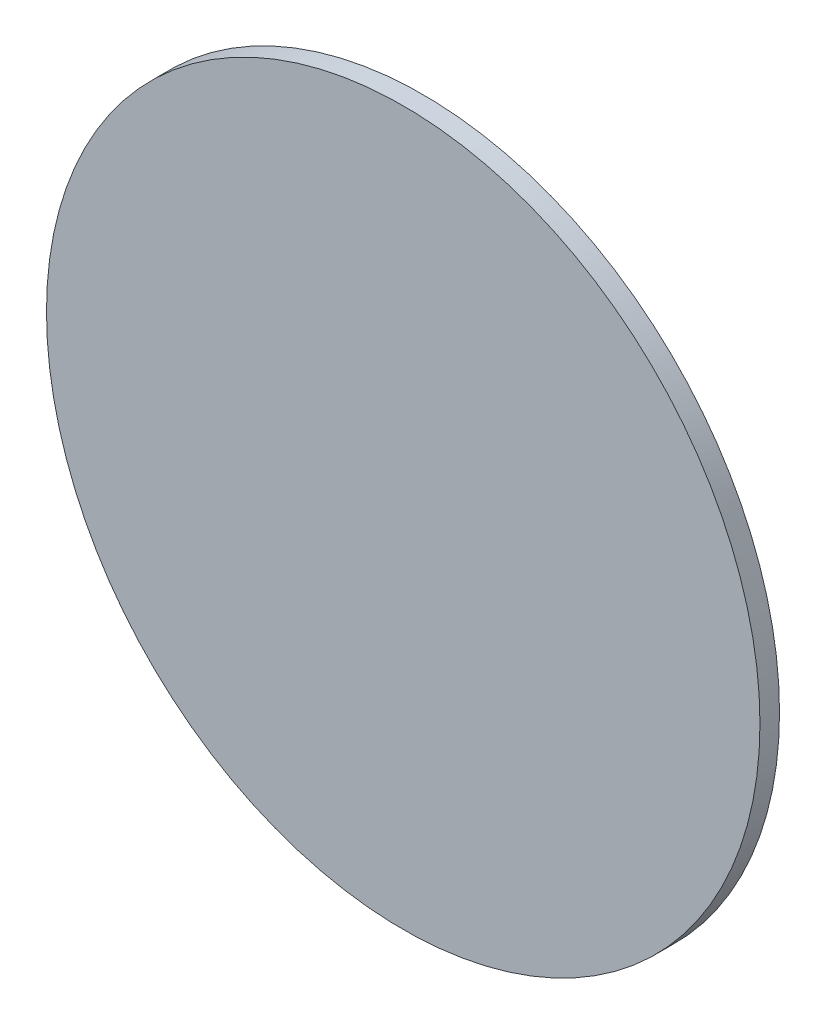
from build123d import *

# Parameters (mm, degrees)
SKETCH1_R           = 36.5
BOSS_EXTRUDE1_DEPTH = 2


with BuildPart() as part:
    # Sketch1 → Boss-Extrude1 (new body)
    with BuildSketch(Plane.XY):
        Circle(SKETCH1_R)
    extrude(amount=BOSS_EXTRUDE1_DEPTH)


solid = part.part
